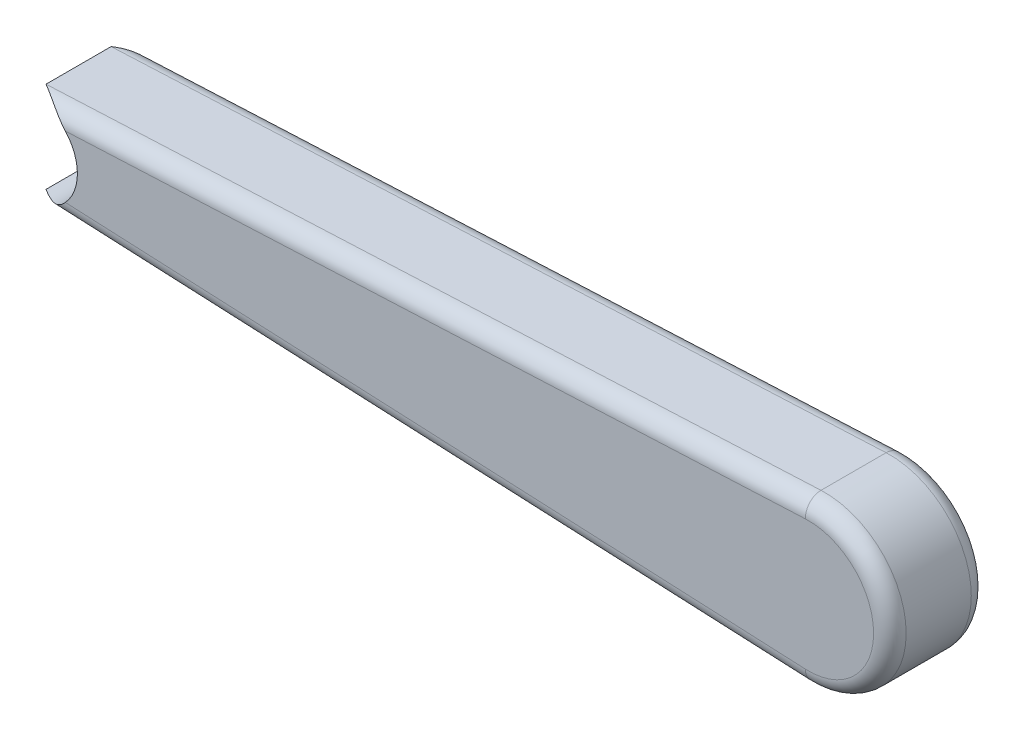
from build123d import *

# Parameters (mm, degrees)
BOSS_EXTRUDE1_DEPTH = 15
SKETCH2_R           = 5
CUT_EXTRUDE1_DEPTH  = 10
FILLET1_R           = 2.5


with BuildPart() as part:
    # Sketch1 → Boss-Extrude1 (new body)
    with BuildSketch(Plane.XY):
        with BuildLine():
            ThreePointArc((-59.685185955, 6.992550832), (-52.362334802, 0), (-59.685185955, -6.992550832))
            Line((-59.685185955, -6.992550832), (59.311145469, -12.486697922))
            ThreePointArc((59.311145469, -12.486697922), (72.387665198, 1.24e-07), (59.311145222, 12.486697911))
            Line((59.311145222, 12.486697911), (-59.685185955, 6.992550832))
        make_face()
    extrude(amount=BOSS_EXTRUDE1_DEPTH)

    # Sketch2 → Cut-Extrude1 (cut)
    with BuildSketch(Plane(origin=(0, 0, 0), x_dir=(-1, 0, 0), z_dir=(0, 0, -1))):
        with Locations((-59.887665198, 0)):
            Circle(SKETCH2_R)
    extrude(amount=-CUT_EXTRUDE1_DEPTH, mode=Mode.SUBTRACT)

    # Fillet1
    fillet1_edges = [part.edges().sort_by_distance(p)[0] for p in [
        (72.387665198, 1.24e-07, 15),
        (-0.187020366, 9.739624371, 15),
        (-0.187020243, -9.739624377, 15),
        (-0.187020366, 9.739624371, 0),
        (72.387665198, 1.24e-07, 0),
        (-0.187020243, -9.739624377, 0),
    ]]
    fillet(fillet1_edges, radius=FILLET1_R)


solid = part.part
